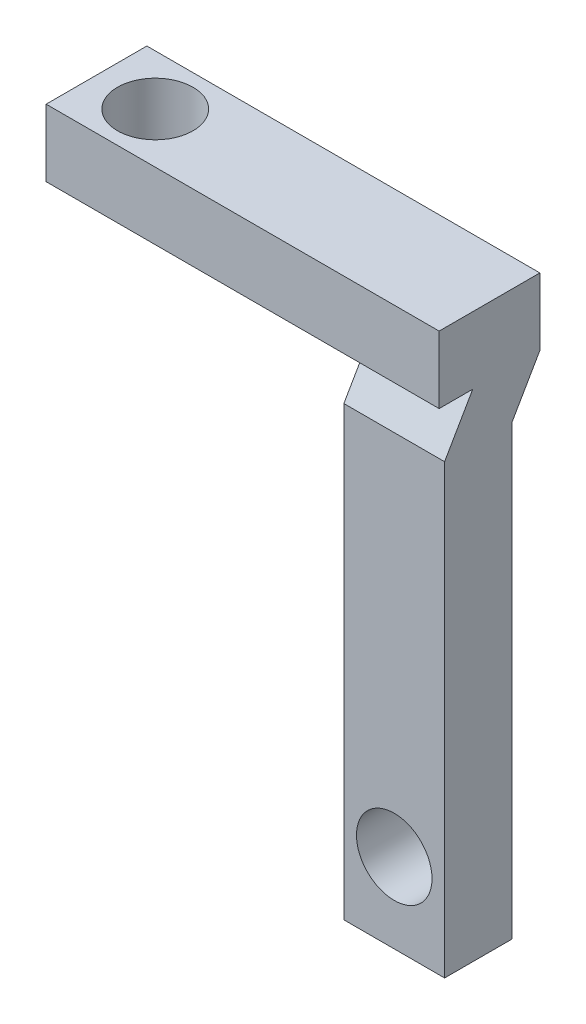
from build123d import *

# Parameters (mm, degrees)
BOSS_EXTRUDE1_DEPTH = 12
BOSS_EXTRUDE2_DEPTH = 46.82
SKETCH3_R           = 4.5
CUT_EXTRUDE2_DEPTH  = 8
SKETCH5_R           = 4.5
CUT_EXTRUDE4_DEPTH  = 8


with BuildPart() as part:
    # Sketch1 → Boss-Extrude1 (new body)
    with BuildSketch(Plane(origin=(0, 0, 0), x_dir=(0, 0, -1), z_dir=(1, 0, 0))):
        Polygon((475.915980223, -8), (483.915980223, -8), (480.565980223, -13.802370205), (480.565980223, -67.07), (472.565980223, -67.07), (472.565980223, -13.802370205), align=None)
    extrude(amount=-BOSS_EXTRUDE1_DEPTH)

    # Sketch1<3> → Boss-Extrude2 (add)
    with BuildSketch(Plane(origin=(0, 0, 0), x_dir=(0, 0, -1), z_dir=(1, 0, 0))):
        Polygon((471.915980223, -8), (475.915980223, -8), (483.915980223, -8), (483.915980223, 0), (471.915980223, 0), align=None)
    extrude(amount=-BOSS_EXTRUDE2_DEPTH)

    # Sketch3 → Cut-Extrude2 (cut)
    with BuildSketch(Plane.XZ.offset(8)):
        with Locations(Location((-39.82, -477.915980223, 0), (0, 0, 270))):
            Circle(SKETCH3_R)
    extrude(amount=-CUT_EXTRUDE2_DEPTH, mode=Mode.SUBTRACT)

    # Sketch5 → Cut-Extrude4 (cut)
    with BuildSketch(Plane.XY.offset(-472.565980223)):
        with Locations((-6, -57.57)):
            Circle(SKETCH5_R)
    extrude(amount=-CUT_EXTRUDE4_DEPTH, mode=Mode.SUBTRACT)


solid = part.part
